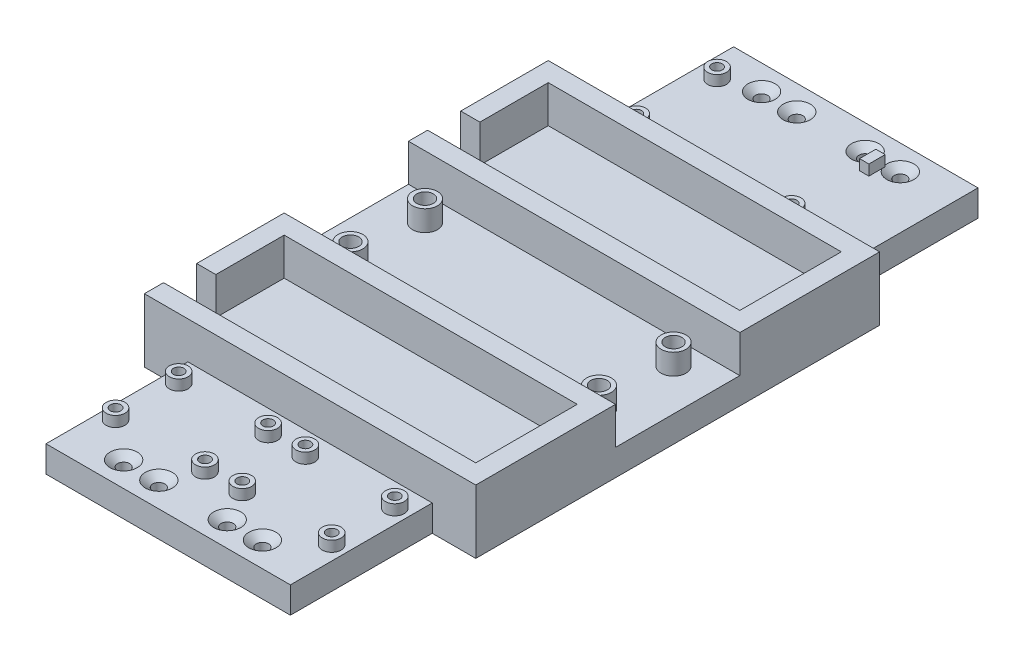
from build123d import *

# Parameters (mm, degrees)
SKETCH2_W                                         = 80
SKETCH2_H                                         = 166
BOSS_EXTRUDE1_DEPTH                               = 6.35
CSK_FOR_4_FLAT_HEAD_MACHINE_SCREW_100_D           = 2.9464
CSK_FOR_4_FLAT_HEAD_MACHINE_SCREW_100_CSINK_D     = 6.5493138
CSK_FOR_4_FLAT_HEAD_MACHINE_SCREW_100_CSINK_ANGLE = 100
MIRROR2_COPY_1_D                                  = 2.9464
MIRROR2_COPY_1_CSINK_D                            = 6.5493138
MIRROR2_COPY_1_CSINK_ANGLE                        = 100
SKETCH9_R                                         = 3
SKETCH9_R_2                                       = 2
BOSS_EXTRUDE3_DEPTH                               = 5
BOSS_EXTRUDE5_DEPTH                               = 9
SKETCH10_R                                        = 2.27
SKETCH10_R_2                                      = 1.27
SKETCH10_W                                        = 2.25
SKETCH10_H                                        = 3.943234712
BOSS_EXTRUDE4_DEPTH                               = 2.54
SKETCH11_R                                        = 2
SKETCH11_R_2                                      = 1.27
CUT_EXTRUDE1_DEPTH                                = 93.574294488
CUT_EXTRUDE2_DEPTH                                = 2.89
SKETCH16_W                                        = 10.5
SKETCH16_H                                        = 34.25
CUT_EXTRUDE4_DEPTH                                = 93.574294488
CUT_EXTRUDE3_DEPTH                                = 3.81


with BuildPart() as part:
    # Sketch2 → Boss-Extrude1 (new body)
    with BuildSketch(Plane(origin=(0, 0, 0), x_dir=(1, 0, 0), z_dir=(0, 1, 0))):
        Rectangle(SKETCH2_W, SKETCH2_H)
    extrude(amount=BOSS_EXTRUDE1_DEPTH)

    # CSK for #4 Flat Head Machine Screw (100)1 (through all)
    with Locations(Plane(origin=(0, 6.35, 0), x_dir=(1, 0, 0), z_dir=(0, 1, 0))):
        with Locations((16.755, 77), (8.255, 77)):
            csk_for_4_flat_head_machine_screw_100 = CounterSinkHole(CSK_FOR_4_FLAT_HEAD_MACHINE_SCREW_100_D / 2, CSK_FOR_4_FLAT_HEAD_MACHINE_SCREW_100_CSINK_D / 2, counter_sink_angle=CSK_FOR_4_FLAT_HEAD_MACHINE_SCREW_100_CSINK_ANGLE)

    # Mirror1: CSK for #4 Flat Head Machine Screw (100)1 across plane
    add(csk_for_4_flat_head_machine_screw_100.mirror(Plane.XY), mode=Mode.SUBTRACT)

    # Mirror2: CSK for #4 Flat Head Machine Screw (100)1 across plane
    add(csk_for_4_flat_head_machine_screw_100.mirror(Plane(origin=(0, 0, 0), x_dir=(0, 0, 1), z_dir=(1, 0, 0))), mode=Mode.SUBTRACT)

    # Mirror2 copy 1 (through all)
    with Locations(Plane(origin=(0, 6.35, 0), x_dir=(-1, 0, 0), z_dir=(0, 1, 0))):
        with Locations((16.755, 77), (8.255, 77)):
            CounterSinkHole(MIRROR2_COPY_1_D / 2, MIRROR2_COPY_1_CSINK_D / 2, counter_sink_angle=MIRROR2_COPY_1_CSINK_ANGLE)

    # Sketch9 → Boss-Extrude3 (add)
    # profile 1 of 4: a face of its own
    with BuildSketch(Plane(origin=(0, 6.35, 0), x_dir=(1, 0, 0), z_dir=(0, 1, 0))):
        with Locations(Location((-30, -9, 0), (0, 0, 270))):
            Circle(SKETCH9_R)
        with Locations(Location((-30, -9, 0), (0, 0, 270))):
            Circle(SKETCH9_R_2, mode=Mode.SUBTRACT)
    # profile 2 of 4: a face of its own
    with BuildSketch(Plane(origin=(0, 6.35, 0), x_dir=(1, 0, 0), z_dir=(0, 1, 0))):
        with Locations(Location((-30, 9, 0), (0, 0, 270))):
            Circle(SKETCH9_R)
        with Locations(Location((-30, 9, 0), (0, 0, 270))):
            Circle(SKETCH9_R_2, mode=Mode.SUBTRACT)
    # profile 3 of 4: a face of its own
    with BuildSketch(Plane(origin=(0, 6.35, 0), x_dir=(1, 0, 0), z_dir=(0, 1, 0))):
        with Locations(Location((30, 9, 0), (0, 0, 270))):
            Circle(SKETCH9_R)
        with Locations(Location((30, 9, 0), (0, 0, 270))):
            Circle(SKETCH9_R_2, mode=Mode.SUBTRACT)
    # profile 4 of 4: a face of its own
    with BuildSketch(Plane(origin=(0, 6.35, 0), x_dir=(1, 0, 0), z_dir=(0, 1, 0))):
        with Locations(Location((30, -9, 0), (0, 0, 270))):
            Circle(SKETCH9_R)
        with Locations(Location((30, -9, 0), (0, 0, 270))):
            Circle(SKETCH9_R_2, mode=Mode.SUBTRACT)
    extrude(amount=BOSS_EXTRUDE3_DEPTH)

    # Sketch15 → Boss-Extrude5 (add)
    with BuildSketch(Plane(origin=(0, 6.35, 0), x_dir=(1, 0, 0), z_dir=(0, 1, 0))):
        Polygon((-35.375, 44.125), (35.375, 44.125), (35.375, 19.625), (-40, 19.625), (-40, 15), (40, 15), (40, 48.75), (-40, 48.75), (-40, 27.625), (-35.375, 27.625), align=None)
        Polygon((-40, -15), (40, -15), (40, -48.75), (-40, -48.75), (-40, -44.125), (35.375, -44.125), (35.375, -19.625), (-35.375, -19.625), (-35.375, -36.125), (-40, -36.125), align=None)
    extrude(amount=BOSS_EXTRUDE5_DEPTH)

    # Sketch10 → Boss-Extrude4 (add)
    # profile 1 of 12: a face of its own
    with BuildSketch(Plane(origin=(0, 6.35, 0), x_dir=(1, 0, 0), z_dir=(0, 1, 0))):
        with Locations(Location((-4.5, -54.38, 0), (0, 0, 270))):
            Circle(SKETCH10_R)
        with Locations(Location((-4.5, -54.38, 0), (0, 0, 270))):
            Circle(SKETCH10_R_2, mode=Mode.SUBTRACT)
    # profile 2 of 12: a face of its own
    with BuildSketch(Plane(origin=(0, 6.35, 0), x_dir=(1, 0, 0), z_dir=(0, 1, 0))):
        with Locations(Location((-4.5, -69.62, 0), (0, 0, 270))):
            Circle(SKETCH10_R)
        with Locations(Location((-4.5, -69.62, 0), (0, 0, 270))):
            Circle(SKETCH10_R_2, mode=Mode.SUBTRACT)
    # profile 3 of 12: a face of its own
    with BuildSketch(Plane(origin=(0, 6.35, 0), x_dir=(1, 0, 0), z_dir=(0, 1, 0))):
        with Locations(Location((-26.09, -54.38, 0), (0, 0, 270))):
            Circle(SKETCH10_R)
        with Locations(Location((-26.09, -54.38, 0), (0, 0, 270))):
            Circle(SKETCH10_R_2, mode=Mode.SUBTRACT)
    # profile 4 of 12: a face of its own
    with BuildSketch(Plane(origin=(0, 6.35, 0), x_dir=(1, 0, 0), z_dir=(0, 1, 0))):
        with Locations(Location((-26.09, -69.62, 0), (0, 0, 270))):
            Circle(SKETCH10_R)
        with Locations(Location((-26.09, -69.62, 0), (0, 0, 270))):
            Circle(SKETCH10_R_2, mode=Mode.SUBTRACT)
    # profile 5 of 12: a face of its own
    with BuildSketch(Plane(origin=(0, 6.35, 0), x_dir=(1, 0, 0), z_dir=(0, 1, 0))):
        with Locations(Location((4.5, -54.38, 0), (0, 0, 270))):
            Circle(SKETCH10_R)
        with Locations(Location((4.5, -54.38, 0), (0, 0, 270))):
            Circle(SKETCH10_R_2, mode=Mode.SUBTRACT)
    # profile 6 of 12: a face of its own
    with BuildSketch(Plane(origin=(0, 6.35, 0), x_dir=(1, 0, 0), z_dir=(0, 1, 0))):
        with Locations(Location((4.5, -69.62, 0), (0, 0, 270))):
            Circle(SKETCH10_R)
        with Locations(Location((4.5, -69.62, 0), (0, 0, 270))):
            Circle(SKETCH10_R_2, mode=Mode.SUBTRACT)
    # profile 7 of 12: a face of its own
    with BuildSketch(Plane(origin=(0, 6.35, 0), x_dir=(1, 0, 0), z_dir=(0, 1, 0))):
        with Locations(Location((26.09, -69.62, 0), (0, 0, 270))):
            Circle(SKETCH10_R)
        with Locations(Location((26.09, -69.62, 0), (0, 0, 270))):
            Circle(SKETCH10_R_2, mode=Mode.SUBTRACT)
    # profile 8 of 12: a face of its own
    with BuildSketch(Plane(origin=(0, 6.35, 0), x_dir=(1, 0, 0), z_dir=(0, 1, 0))):
        with Locations(Location((26.09, -54.38, 0), (0, 0, 270))):
            Circle(SKETCH10_R)
        with Locations(Location((26.09, -54.38, 0), (0, 0, 270))):
            Circle(SKETCH10_R_2, mode=Mode.SUBTRACT)
    # profile 9 of 12: a face of its own
    with BuildSketch(Plane(origin=(0, 6.35, 0), x_dir=(1, 0, 0), z_dir=(0, 1, 0))):
        with Locations(Location((12.75, 54.75, 0), (0, 0, 270))):
            Circle(SKETCH10_R)
        with Locations(Location((12.75, 54.75, 0), (0, 0, 270))):
            Circle(SKETCH10_R_2, mode=Mode.SUBTRACT)
    # profile 10 of 12: a face of its own
    with BuildSketch(Plane(origin=(0, 6.35, 0), x_dir=(1, 0, 0), z_dir=(0, 1, 0))):
        with Locations(Location((-24.75, 54.75, 0), (0, 0, 270))):
            Circle(SKETCH10_R)
        with Locations(Location((-24.75, 54.75, 0), (0, 0, 270))):
            Circle(SKETCH10_R_2, mode=Mode.SUBTRACT)
    # profile 11 of 12: a face of its own
    with BuildSketch(Plane(origin=(0, 6.35, 0), x_dir=(1, 0, 0), z_dir=(0, 1, 0))):
        with Locations(Location((-24.75, 74.25, 0), (0, 0, 270))):
            Circle(SKETCH10_R)
        with Locations(Location((-24.75, 74.25, 0), (0, 0, 270))):
            Circle(SKETCH10_R_2, mode=Mode.SUBTRACT)
    # profile 12 of 12: a face of its own
    with BuildSketch(Plane(origin=(0, 6.35, 0), x_dir=(1, 0, 0), z_dir=(0, 1, 0))):
        with Locations((12.75, 74.25)):
            Rectangle(SKETCH10_W, SKETCH10_H)
    extrude(amount=BOSS_EXTRUDE4_DEPTH)

    # Sketch11 → Cut-Extrude1 (cut, through all)
    with BuildSketch(Plane(origin=(0, 6.35, 0), x_dir=(1, 0, 0), z_dir=(0, 1, 0))):
        with Locations(Location((-30, -9, 0), (0, 0, 270))):
            Circle(SKETCH11_R)
        with Locations(Location((-30, 9, 0), (0, 0, 270))):
            Circle(SKETCH11_R)
        with Locations(Location((26.09, -54.38, 0), (0, 0, 270))):
            Circle(SKETCH11_R_2)
        with Locations(Location((26.09, -69.62, 0), (0, 0, 270))):
            Circle(SKETCH11_R_2)
        with Locations(Location((4.5, -54.38, 0), (0, 0, 270))):
            Circle(SKETCH11_R_2)
        with Locations(Location((4.5, -69.62, 0), (0, 0, 270))):
            Circle(SKETCH11_R_2)
        with Locations(Location((30, 9, 0), (0, 0, 270))):
            Circle(SKETCH11_R)
        with Locations(Location((30, -9, 0), (0, 0, 270))):
            Circle(SKETCH11_R)
        with Locations(Location((-26.09, -69.62, 0), (0, 0, 270))):
            Circle(SKETCH11_R_2)
        with Locations(Location((-26.09, -54.38, 0), (0, 0, 270))):
            Circle(SKETCH11_R_2)
        with Locations(Location((-4.5, -69.62, 0), (0, 0, 270))):
            Circle(SKETCH11_R_2)
        with Locations(Location((-4.5, -54.38, 0), (0, 0, 270))):
            Circle(SKETCH11_R_2)
        with Locations(Location((12.75, 54.75, 0), (0, 0, 270))):
            Circle(SKETCH11_R_2)
        with Locations(Location((-24.75, 54.75, 0), (0, 0, 270))):
            Circle(SKETCH11_R_2)
        with Locations(Location((-24.75, 74.25, 0), (0, 0, 270))):
            Circle(SKETCH11_R_2)
    extrude(amount=-CUT_EXTRUDE1_DEPTH, mode=Mode.SUBTRACT)

    # Sketch12 → Cut-Extrude2 (cut)
    with BuildSketch(Plane.XZ):
        Polygon((-23.59, 52.936624327), (-23.59, 55.823375673), (-26.09, 57.266751346), (-28.59, 55.823375673), (-28.59, 52.936624327), (-26.09, 51.493248654), align=None)
        Polygon((-2, 52.936624327), (-2, 55.823375673), (-4.5, 57.266751346), (-7, 55.823375673), (-7, 52.936624327), (-4.5, 51.493248654), align=None)
        Polygon((-23.59, 68.176624327), (-23.59, 71.063375673), (-26.09, 72.506751346), (-28.59, 71.063375673), (-28.59, 68.176624327), (-26.09, 66.733248654), align=None)
        Polygon((-2, 68.176624327), (-2, 71.063375673), (-4.5, 72.506751346), (-7, 71.063375673), (-7, 68.176624327), (-4.5, 66.733248654), align=None)
        Polygon((7, 52.936624327), (7, 55.823375673), (4.5, 57.266751346), (2, 55.823375673), (2, 52.936624327), (4.5, 51.493248654), align=None)
        Polygon((7, 68.176624327), (7, 71.063375673), (4.5, 72.506751346), (2, 71.063375673), (2, 68.176624327), (4.5, 66.733248654), align=None)
        Polygon((28.59, 68.176624327), (28.59, 71.063375673), (26.09, 72.506751346), (23.59, 71.063375673), (23.59, 68.176624327), (26.09, 66.733248654), align=None)
        Polygon((28.59, 52.936624327), (28.59, 55.823375673), (26.09, 57.266751346), (23.59, 55.823375673), (23.59, 52.936624327), (26.09, 51.493248654), align=None)
        Polygon((-22.25, -75.693375673), (-22.25, -72.806624327), (-24.75, -71.363248654), (-27.25, -72.806624327), (-27.25, -75.693375673), (-24.75, -77.136751346), align=None)
        Polygon((-22.25, -56.193375673), (-22.25, -53.306624327), (-24.75, -51.863248654), (-27.25, -53.306624327), (-27.25, -56.193375673), (-24.75, -57.636751346), align=None)
        Polygon((15.25, -56.193375673), (15.25, -53.306624327), (12.75, -51.863248654), (10.25, -53.306624327), (10.25, -56.193375673), (12.75, -57.636751346), align=None)
    extrude(amount=-CUT_EXTRUDE2_DEPTH, mode=Mode.SUBTRACT)

    # Sketch16 → Cut-Extrude4 (cut, through all)
    with BuildSketch(Plane(origin=(0, 6.35, 0), x_dir=(1, 0, 0), z_dir=(0, 1, 0))):
        with Locations((34.75, 65.875)):
            Rectangle(SKETCH16_W, SKETCH16_H)
        with Locations((-34.75, 65.875)):
            Rectangle(SKETCH16_W, SKETCH16_H)
        with Locations((-34.75, -65.875)):
            Rectangle(SKETCH16_W, SKETCH16_H)
        with Locations((34.75, -65.875)):
            Rectangle(SKETCH16_W, SKETCH16_H)
    extrude(amount=-CUT_EXTRUDE4_DEPTH, mode=Mode.SUBTRACT)

    # Sketch14 → Cut-Extrude3 (cut)
    with BuildSketch(Plane.XZ):
        Polygon((33.175, 7.166912895), (33.175, 10.833087105), (30, 12.666174209), (26.825, 10.833087105), (26.825, 7.166912895), (30, 5.333825791), align=None)
        Polygon((26.825, -10.833087105), (30, -12.666174209), (33.175, -10.833087105), (33.175, -7.166912895), (30, -5.333825791), (26.825, -7.166912895), align=None)
        Polygon((-26.825, 10.833087105), (-30, 12.666174209), (-33.175, 10.833087105), (-33.175, 7.166912895), (-30, 5.333825791), (-26.825, 7.166912895), align=None)
        Polygon((-33.175, -10.833087105), (-30, -12.666174209), (-26.825, -10.833087105), (-26.825, -7.166912895), (-30, -5.333825791), (-33.175, -7.166912895), align=None)
    extrude(amount=-CUT_EXTRUDE3_DEPTH, mode=Mode.SUBTRACT)


solid = part.part
